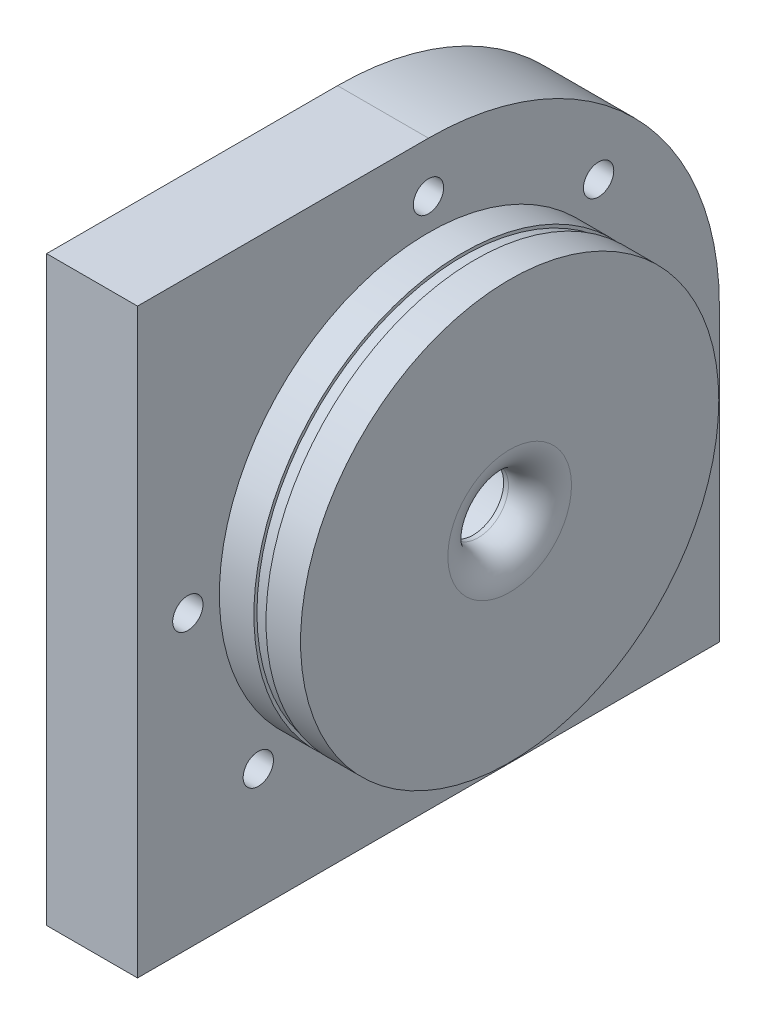
from build123d import *

# Parameters (mm, degrees)
SKETCH1_R                     = 43.815
HOUSING_FITTING_EXTRUDE_DEPTH = 17.018
HOUSING_BODY_1_DEPTH          = 19.05
SKETCH3_R                     = 6.35
IMPELLER_BORE_DEPTH           = 17.018
SKETCH4_R                     = 4
SHAFT_BORE_DEPTH              = 70.612
O_RING_CUT_DEPTH              = 1.27
O_RING_CUT_DEPTH_BACK         = 1.27
SKETCH5_R                     = 43.942
SKETCH5_R_2                   = 43.18
SKETCH12_R                    = 3.175
CUT_EXTRUDE2_DEPTH            = 19.05
CIRPATTERN1_COUNT             = 8
SKETCH14_R                    = 3.175
SKETCH14_R_2                  = 3.392842108
CUT_EXTRUDE4_DEPTH            = 16.51
SKETCH15_R                    = 3.175
CUT_EXTRUDE5_DEPTH            = 10.922
FILLET1_R                     = 6.604
SKETCH16_R                    = 12.954
CUT_EXTRUDE7_DEPTH            = 28.448
SKETCH17_R                    = 15.24
CUT_EXTRUDE8_DEPTH            = 13.97
SKETCH20_R                    = 25.146
CUT_EXTRUDE11_DEPTH           = 6.35


with BuildPart() as part:
    # Sketch1 → Housing Fitting Extrude (new body)
    with BuildSketch(Plane(origin=(0, 0, 0), x_dir=(0, 0, -1), z_dir=(1, 0, 0))):
        Circle(SKETCH1_R)
    extrude(amount=HOUSING_FITTING_EXTRUDE_DEPTH)

    # Sketch2 → Housing Body 1 (add)
    with BuildSketch(Plane.ZY):
        with BuildLine():
            Line((60.96, 0), (60.96, 60.96))
            Line((60.96, 60.96), (0, 60.96))
            ThreePointArc((0, 60.96), (-43.105229381, 43.105229381), (-60.96, 0))
            Line((-60.96, 0), (-60.96, -54.61))
            Line((-60.96, -54.61), (-60.96, -60.96))
            Line((-60.96, -60.96), (60.96, -60.96))
            Line((60.96, -60.96), (60.96, -54.61))
            Line((60.96, -54.61), (60.96, 0))
        make_face()
    extrude(amount=HOUSING_BODY_1_DEPTH)

    # Sketch3 → Impeller Bore (cut)
    with BuildSketch(Plane(origin=(17.018, 0, 0), x_dir=(0, 0, -1), z_dir=(1, 0, 0))):
        Circle(SKETCH3_R)
    extrude(amount=-IMPELLER_BORE_DEPTH, mode=Mode.SUBTRACT)

    # Sketch4 → Shaft Bore (cut)
    with BuildSketch(Plane(origin=(0, 0, 0), x_dir=(0, 0, -1), z_dir=(1, 0, 0))):
        Circle(SKETCH4_R)
    extrude(amount=-SHAFT_BORE_DEPTH, mode=Mode.SUBTRACT)

    # Sketch5 → O-Ring Cut (cut, two sides: drawn at the far end of the back side and taken through both)
    with BuildSketch(Plane(origin=(8.509, 0, 0), x_dir=(0, 0, -1), z_dir=(1, 0, 0)).offset(-O_RING_CUT_DEPTH_BACK)):
        Circle(SKETCH5_R)
        Circle(SKETCH5_R_2, mode=Mode.SUBTRACT)
    extrude(amount=O_RING_CUT_DEPTH + O_RING_CUT_DEPTH_BACK, mode=Mode.SUBTRACT)

    # Sketch12 → Cut-Extrude2 (cut)
    with BuildSketch(Plane(origin=(0, 0, 0), x_dir=(0, 0, -1), z_dir=(1, 0, 0))):
        with Locations((-50.419, 0)):
            Circle(SKETCH12_R)
    cut_extrude2 = extrude(amount=-CUT_EXTRUDE2_DEPTH, mode=Mode.SUBTRACT)

    # CirPattern1: Cut-Extrude2 ×8 about axis, 1 skipped
    cirpattern1_axis = Axis((0, 0, 0), (1, 0, 0))
    add([cut_extrude2.rotate(cirpattern1_axis, i * 360 / CIRPATTERN1_COUNT) for i in range(1, CIRPATTERN1_COUNT) if i not in (7,)], mode=Mode.SUBTRACT)

    # Sketch14 → Cut-Extrude4 (cut)
    with BuildSketch(Plane.XZ.offset(60.96)):
        with Locations(Location((-9.525, -46.754349092, 0), (0, 0, 270))):
            Circle(SKETCH14_R)
        with Locations(Location((-9.525, 41.914080666, 0), (0, 0, 270))):
            Circle(SKETCH14_R_2)
    extrude(amount=-CUT_EXTRUDE4_DEPTH, mode=Mode.SUBTRACT)

    # Sketch15 → Cut-Extrude5 (cut)
    with BuildSketch(Plane(origin=(0, 0, -60.96), x_dir=(-1, 0, 0), z_dir=(0, 0, -1))):
        with Locations(Location((9.525, -39.337514031, 0), (0, 0, 90))):
            Circle(SKETCH15_R)
    extrude(amount=-CUT_EXTRUDE5_DEPTH, mode=Mode.SUBTRACT)

    # Fillet1
    fillet1_edges = [part.edges().sort_by_distance(p)[0] for p in [
        (17.018, 0, 6.35),
    ]]
    fillet(fillet1_edges, radius=FILLET1_R)

    # Sketch16 → Cut-Extrude7 (cut)
    with BuildSketch(Plane.ZY.offset(19.05)):
        Circle(SKETCH16_R)
    extrude(amount=-CUT_EXTRUDE7_DEPTH, mode=Mode.SUBTRACT)

    # Sketch17 → Cut-Extrude8 (cut)
    with BuildSketch(Plane.ZY.offset(19.05)):
        Circle(SKETCH17_R)
    extrude(amount=-CUT_EXTRUDE8_DEPTH, mode=Mode.SUBTRACT)

    # Sketch20 → Cut-Extrude11 (cut)
    with BuildSketch(Plane.ZY.offset(19.05)):
        Circle(SKETCH20_R)
    extrude(amount=-CUT_EXTRUDE11_DEPTH, mode=Mode.SUBTRACT)


solid = part.part
